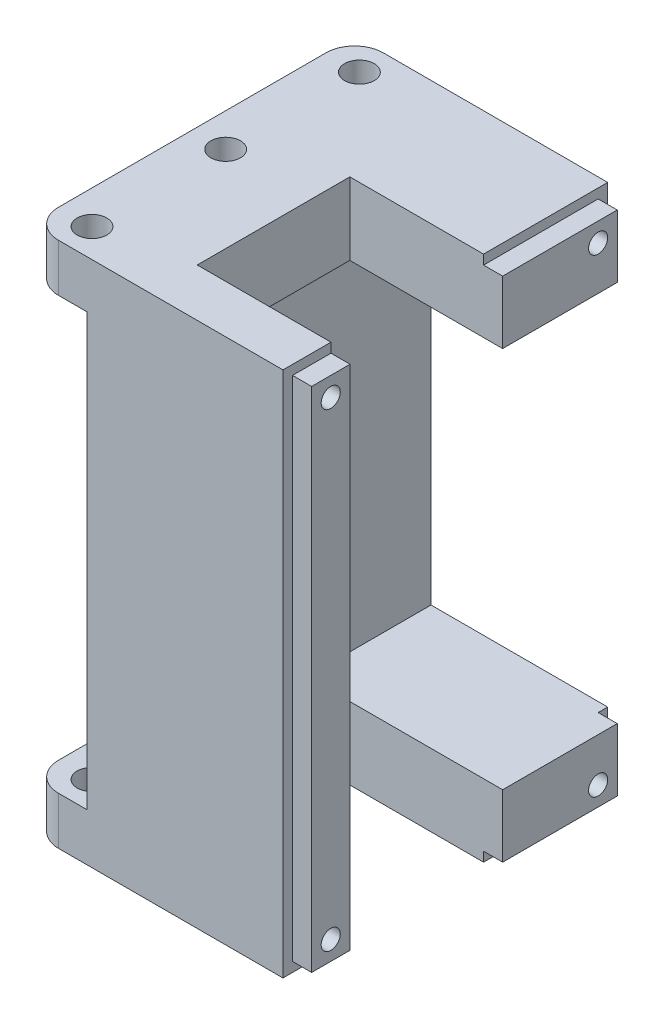
from build123d import *

# Parameters (mm, degrees)
SKETCH_1_W           = 20.5
SKETCH_1_H           = 15.141704846
SKETCH_1_R           = 2
EXTRUDE_1_DEPTH      = 29
EXTRUDE_1_2_DEPTH    = 29
SKETCH_2_W           = 20.5
SKETCH_2_H           = 70.283409692
EXTRUDE_2_DEPTH      = 3
SKETCH_3_W           = 20.5
SKETCH_3_H           = 7.570852423
CUT_EXTRUDE_1_DEPTH  = 49.621002864
EXTRUDE_3_DEPTH      = 10
CUT_EXTRUDE_2_REACH  = 75.297
SKETCH_8_R           = 1.6
SKETCH_9_W           = 20.5
SKETCH_9_H           = 32
CUT_EXTRUDE_3_DEPTH  = 65.572982844
SKETCH_12_W          = 20.5
SKETCH_12_H          = 7.570852423
SKETCH_12_R          = 2
EXTRUDE_5_DEPTH      = 30
SKETCH_13_R          = 4
SKETCH_13_R_2        = 2.5
EXTRUDE_6_DEPTH      = 10
CUT_EXTRUDE_5_DEPTH  = 48.388093988
CUT_EXTRUDE_6_DEPTH  = 51.404676959
EXTRUDE_START        = 10
EXTRUDE_7_DEPTH      = 10
CUT_EXTRUDE_7_DEPTH  = 48.388094067
CUT_EXTRUDE_8_DEPTH  = 51.404676959
SKETCH_23_W          = 20.5
SKETCH_23_H          = 55.141704846
EXTRUDE_8_DEPTH      = 2
SKETCH_24_W          = 10
SKETCH_24_H          = 55.141704846
EXTRUDE_9_DEPTH      = 2
SKETCH_25_W          = 8
SKETCH_25_H          = 7.570852423
CUT_EXTRUDE_9_DEPTH  = 16
EXTRUDE_START_2      = 20
SKETCH_26_R          = 2
EXTRUDE_10_DEPTH     = 20
SKETCH_27_W          = 16
SKETCH_27_H          = 8
CUT_EXTRUDE_10_DEPTH = 75.494994619
SKETCH_29_W          = 34
SKETCH_29_H          = 55.141704846
SKETCH_29_W_2        = 32
SKETCH_29_H_2        = 53.141704846
CUT_EXTRUDE_11_DEPTH = 2
SKETCH_32_W          = 15.976862795
SKETCH_32_H          = 55.18580585
CUT_EXTRUDE_13_DEPTH = 16
SKETCH_33_R          = 1
CUT_EXTRUDE_14_DEPTH = 16
SKETCH_35_R          = 1
CUT_EXTRUDE_15_DEPTH = 5
SKETCH_36_R          = 2.65
CUT_EXTRUDE_16_DEPTH = 10
CUT_EXTRUDE_START    = -10
SKETCH_37_R          = 2.65
CUT_EXTRUDE_17_DEPTH = 10
SKETCH_38_W          = 37
SKETCH_38_H          = 68
CUT_EXTRUDE_18_DEPTH = 10
SKETCH_39_W          = 24
SKETCH_39_H          = 55.141704846
EXTRUDE_11_DEPTH     = 2
SKETCH_40_W          = 20.5
SKETCH_40_H          = 34
CUT_EXTRUDE_19_DEPTH = 66.929281153
SKETCH_41_W          = 5
SKETCH_41_H          = 34
EXTRUDE_12_DEPTH     = 5
SKETCH_42_R          = 2
CUT_EXTRUDE_20_DEPTH = 68.038571833
SKETCH_43_W          = 1
SKETCH_43_H          = 34
EXTRUDE_13_DEPTH     = 5
SKETCH_44_W          = 34
SKETCH_44_H          = 5
EXTRUDE_14_DEPTH     = 1
EXTRUDE_START_3      = -5
SKETCH_45_R          = 2
SKETCH_45_R_2        = 1.55
EXTRUDE_15_DEPTH     = 5
SKETCH_46_R          = 2
SKETCH_46_R_2        = 1.55
EXTRUDE_16_DEPTH     = 5
FILLET_1_R           = 3
FILLET_2_R           = 3
FILLET_3_R           = 3
FILLET_4_R           = 3
SKETCH_47_R          = 2
EXTRUDE_17_DEPTH     = 10
SKETCH_48_R          = 2
CUT_EXTRUDE_21_DEPTH = 10


with BuildPart() as part:
    # 草图1 → 凸台-拉伸1 (new body)
    with BuildSketch(Plane.XY):
        with Locations((0, -27.570852423)):
            Rectangle(SKETCH_1_W, SKETCH_1_H)
        with Locations((-5, -25)):
            Circle(SKETCH_1_R, mode=Mode.SUBTRACT)
        with Locations((5, -25)):
            Circle(SKETCH_1_R, mode=Mode.SUBTRACT)
    extrude(amount=EXTRUDE_1_DEPTH)



with BuildPart() as body_2:
    # 草图1 → Extrude 1 2 (new body)
    with BuildSketch(Plane.XY):
        with Locations((0, 27.570852423)):
            Rectangle(SKETCH_1_W, SKETCH_1_H)
        with Locations((5, 25)):
            Circle(SKETCH_1_R, mode=Mode.SUBTRACT)
        with Locations((-5, 25)):
            Circle(SKETCH_1_R, mode=Mode.SUBTRACT)
    extrude(amount=EXTRUDE_1_2_DEPTH)


with BuildPart() as part_1:
    add(part.part)

    add(body_2.part)  # 凸台-拉伸2 merges body 2
    # 草图2 → 凸台-拉伸2 (add)
    with BuildSketch(Plane.XY.offset(29)):
        Rectangle(SKETCH_2_W, SKETCH_2_H)
    extrude(amount=EXTRUDE_2_DEPTH)

    # 草图3 → 切除-拉伸1 (cut, through all)
    with BuildSketch(Plane(origin=(0, 0, 0), x_dir=(-1, 0, 0), z_dir=(0, 0, -1))):
        with Locations((0, -31.356278635)):
            Rectangle(SKETCH_3_W, SKETCH_3_H)
        with Locations((0, 31.356278635)):
            Rectangle(SKETCH_3_W, SKETCH_3_H)
    extrude(amount=-CUT_EXTRUDE_1_DEPTH, mode=Mode.SUBTRACT)

    # 草图5 → 凸台-拉伸3 (add)
    with BuildSketch(Plane.XZ.offset(27.570852423)):
        with BuildLine():
            ThreePointArc((0, 0), (1.767766953, 0.732233047), (2.5, 2.5))
            ThreePointArc((2.5, 2.5), (-1.767766953, 4.267766953), (0, 0))
        make_face()
    extrude(amount=EXTRUDE_3_DEPTH)

    # 草图8 → 切除-拉伸2 (cut, up to next)
    with BuildSketch(Plane(origin=(0, 27.570852423, 0), x_dir=(1, 0, 0), z_dir=(0, 1, 0)), mode=Mode.PRIVATE) as cut_extrude_2_sk1:
        with Locations((0, -16.5)):
            Circle(SKETCH_8_R)
    cut_extrude_2_tool1 = extrude(cut_extrude_2_sk1.sketch, amount=-CUT_EXTRUDE_2_REACH, mode=Mode.PRIVATE) & part_1.part
    # 草图8 → 切除-拉伸2 (cut, up to next)
    with BuildSketch(Plane(origin=(0, 27.570852423, 0), x_dir=(1, 0, 0), z_dir=(0, 1, 0)), mode=Mode.PRIVATE) as cut_extrude_2_sk2:
        with Locations((0, -26.5)):
            Circle(SKETCH_8_R)
    cut_extrude_2_tool2 = extrude(cut_extrude_2_sk2.sketch, amount=-CUT_EXTRUDE_2_REACH, mode=Mode.PRIVATE) & part_1.part
    add(cut_extrude_2_tool1.solids().sort_by_distance((0, 27.570852, 16.5))[0], mode=Mode.SUBTRACT)
    add(cut_extrude_2_tool2.solids().sort_by_distance((0, 27.570852, 26.5))[0], mode=Mode.SUBTRACT)

    # 草图9 → 切除-拉伸3 (cut, through all)
    with BuildSketch(Plane.XZ.offset(27.570852423)):
        with Locations((0, 16)):
            Rectangle(SKETCH_9_W, SKETCH_9_H)
    extrude(amount=CUT_EXTRUDE_3_DEPTH, mode=Mode.SUBTRACT)

    # 草图12 → 凸台-拉伸5 (add)
    with BuildSketch(Plane(origin=(0, 0, 0), x_dir=(-1, 0, 0), z_dir=(0, 0, -1))):
        with Locations((0, 23.785426212)):
            Rectangle(SKETCH_12_W, SKETCH_12_H)
        with Locations((-5, 25)):
            Circle(SKETCH_12_R, mode=Mode.SUBTRACT)
        with Locations((5, 25)):
            Circle(SKETCH_12_R, mode=Mode.SUBTRACT)
    extrude(amount=-EXTRUDE_5_DEPTH)

    # 草图13 → 凸台-拉伸6 (add)
    with BuildSketch(Plane(origin=(0, 27.570852423, 0), x_dir=(1, 0, 0), z_dir=(0, 1, 0))):
        with Locations((0, -5)):
            Circle(SKETCH_13_R)
        with Locations((0, -5)):
            Circle(SKETCH_13_R_2, mode=Mode.SUBTRACT)
    extrude(amount=EXTRUDE_6_DEPTH)

    # 草图15 → 旋转1 (revolve)
    with BuildSketch(Plane(origin=(0, 0, 0), x_dir=(0, 0, -1), z_dir=(1, 0, 0))):
        with BuildLine():
            Line((-1, 27.570852423), (0, 27.570852423))
            ThreePointArc((0, 27.570852423), (-0.712891912, 27.930797461), (-1, 28.676011695))
            Line((-1, 28.676011695), (-1, 27.570852423))
        make_face()
    revolve(axis=Axis((0, -962.429147577, 5), (0, 1, 0)))

    # 草图16 → 切除-拉伸5 (cut, through all)
    with BuildSketch(Plane.XY.offset(5)):
        with BuildLine():
            ThreePointArc((0, 35.070852423), (-1.060660172, 32.510192251), (1.5, 33.570852423))
            ThreePointArc((1.5, 33.570852423), (1.060660172, 34.631512595), (0, 35.070852423))
        make_face()
    extrude(amount=-CUT_EXTRUDE_5_DEPTH, mode=Mode.SUBTRACT)

    # 草图17 → 切除-拉伸6 (cut, through all)
    with BuildSketch(Plane(origin=(0, 0, 0), x_dir=(0, 0, -1), z_dir=(1, 0, 0))):
        with BuildLine():
            ThreePointArc((-5, 35.070852423), (-6.060660172, 32.510192251), (-3.5, 33.570852423))
            ThreePointArc((-3.5, 33.570852423), (-3.939339828, 34.631512595), (-5, 35.070852423))
        make_face()
    extrude(amount=-CUT_EXTRUDE_6_DEPTH, mode=Mode.SUBTRACT)

    # 草图19 → 凸台-拉伸7 (add)
    with BuildSketch(Plane.XZ.offset(27.570852423).offset(EXTRUDE_START)):
        with BuildLine():
            ThreePointArc((4, 5), (-2.828427125, 7.828427125), (0, 1))
            ThreePointArc((0, 1), (2.828427125, 2.171572875), (4, 5))
        make_face()
        with BuildLine():
            ThreePointArc((2.5, 5), (1.767766953, 3.232233047), (0, 2.5))
            ThreePointArc((0, 2.5), (-1.767766953, 6.767766953), (2.5, 5))
        make_face(mode=Mode.SUBTRACT)
    extrude(amount=-EXTRUDE_7_DEPTH)

    # 草图20 → 旋转2 (revolve)
    with BuildSketch(Plane(origin=(0, 0, 0), x_dir=(0, 0, -1), z_dir=(1, 0, 0))):
        with BuildLine():
            Line((-1, -27.570852423), (0, -27.570852423))
            ThreePointArc((0, -27.570852423), (-0.707106781, -27.863745642), (-1, -28.570852423))
            Line((-1, -28.570852423), (-1, -27.570852423))
        make_face()
    revolve(axis=Axis((0, -1027.570852423, 5), (0, 1, 0)))

    # 草图21 → 切除-拉伸7 (cut, through all)
    with BuildSketch(Plane.XY.offset(5)):
        with BuildLine():
            ThreePointArc((0, -35.070852423), (1.060660172, -34.631512595), (1.5, -33.570852423))
            ThreePointArc((1.5, -33.570852423), (-1.060660172, -32.510192251), (0, -35.070852423))
        make_face()
    extrude(amount=-CUT_EXTRUDE_7_DEPTH, mode=Mode.SUBTRACT)

    # 草图22 → 切除-拉伸8 (cut, through all)
    with BuildSketch(Plane(origin=(0, 0, 0), x_dir=(0, 0, -1), z_dir=(1, 0, 0))):
        with BuildLine():
            ThreePointArc((-5, -35.070852423), (-3.939339828, -34.631512595), (-3.5, -33.570852423))
            ThreePointArc((-3.5, -33.570852423), (-6.060660172, -32.510192251), (-5, -35.070852423))
        make_face()
    extrude(amount=-CUT_EXTRUDE_8_DEPTH, mode=Mode.SUBTRACT)

    # 草图23 → 凸台-拉伸8 (add)
    with BuildSketch(Plane.XY.offset(32)):
        Rectangle(SKETCH_23_W, SKETCH_23_H)
    extrude(amount=EXTRUDE_8_DEPTH)

    # 草图24 → 凸台-拉伸9 (add)
    with BuildSketch(Plane.ZY.offset(10.25)):
        with Locations((29, 0)):
            Rectangle(SKETCH_24_W, SKETCH_24_H)
    extrude(amount=EXTRUDE_9_DEPTH)

    # 草图25 → 切除-拉伸9 (cut)
    with BuildSketch(Plane(origin=(10.25, 0, 0), x_dir=(0, 0, -1), z_dir=(1, 0, 0))):
        with Locations((-21, 23.785426212)):
            Rectangle(SKETCH_25_W, SKETCH_25_H)
        with Locations((-21, -23.785426212)):
            Rectangle(SKETCH_25_W, SKETCH_25_H)
    extrude(amount=-CUT_EXTRUDE_9_DEPTH, mode=Mode.SUBTRACT)

    # 草图26 → 凸台-拉伸10 (add)
    with BuildSketch(Plane(origin=(0, 0, 29), x_dir=(-1, 0, 0), z_dir=(0, 0, -1)).offset(EXTRUDE_START_2)):
        with Locations((-5, 25)):
            Circle(SKETCH_26_R)
        with Locations((5, 25)):
            Circle(SKETCH_26_R)
        with Locations((-5, -25)):
            Circle(SKETCH_26_R)
        with Locations((5, -25)):
            Circle(SKETCH_26_R)
    extrude(amount=-EXTRUDE_10_DEPTH)

    # 草图27 → 切除-拉伸10 (cut, through all)
    with BuildSketch(Plane.XZ.offset(27.570852423)):
        with Locations((2.25, 21)):
            Rectangle(SKETCH_27_W, SKETCH_27_H)
    extrude(amount=-CUT_EXTRUDE_10_DEPTH, mode=Mode.SUBTRACT)

    # 草图29 → 切除-拉伸11 (cut)
    with BuildSketch(Plane(origin=(10.25, 0, 0), x_dir=(0, 0, -1), z_dir=(1, 0, 0))):
        with Locations((-17, 0)):
            Rectangle(SKETCH_29_W, SKETCH_29_H)
        with Locations((-17, 0)):
            Rectangle(SKETCH_29_W_2, SKETCH_29_H_2, mode=Mode.SUBTRACT)
    extrude(amount=-CUT_EXTRUDE_11_DEPTH, mode=Mode.SUBTRACT)

    # 草图32 → 切除-拉伸13 (cut)
    with BuildSketch(Plane(origin=(10.25, 0, 0), x_dir=(0, 0, -1), z_dir=(1, 0, 0))):
        with Locations((-20.988431398, 0.000987062)):
            Rectangle(SKETCH_32_W, SKETCH_32_H)
    extrude(amount=-CUT_EXTRUDE_13_DEPTH, mode=Mode.SUBTRACT)

    # 草图33 → 切除-拉伸14 (cut)
    with BuildSketch(Plane(origin=(10.25, 0, 0), x_dir=(0, 0, -1), z_dir=(1, 0, 0))):
        with Locations((-31, 24.570852423)):
            Circle(SKETCH_33_R)
        with Locations((-31, -24.570852423)):
            Circle(SKETCH_33_R)
    extrude(amount=-CUT_EXTRUDE_14_DEPTH, mode=Mode.SUBTRACT)

    # 草图35 → 切除-拉伸15 (cut)
    with BuildSketch(Plane(origin=(10.25, 0, 0), x_dir=(0, 0, -1), z_dir=(1, 0, 0))):
        with Locations((-3, 24.570852423)):
            Circle(SKETCH_35_R)
        with Locations((-3, -24.570852423)):
            Circle(SKETCH_35_R)
    extrude(amount=-CUT_EXTRUDE_15_DEPTH, mode=Mode.SUBTRACT)

    # 草图36 → 切除-拉伸16 (cut)
    with BuildSketch(Plane.XZ.offset(37.570852423)):
        with Locations((0, 5)):
            Circle(SKETCH_36_R)
    extrude(amount=-CUT_EXTRUDE_16_DEPTH, mode=Mode.SUBTRACT)

    # 草图37 → 切除-拉伸17 (cut)
    with BuildSketch(Plane(origin=(0, 37.570852423, 0), x_dir=(1, 0, 0), z_dir=(0, 1, 0)).offset(CUT_EXTRUDE_START)):
        with Locations((0, -5)):
            Circle(SKETCH_37_R)
    extrude(amount=CUT_EXTRUDE_17_DEPTH, mode=Mode.SUBTRACT)

    # 草图38 → 切除-拉伸18 (cut)
    with BuildSketch(Plane.XZ.offset(27.570852423)):
        with Locations((-10.25, 0)):
            Rectangle(SKETCH_38_W, SKETCH_38_H)
    extrude(amount=CUT_EXTRUDE_18_DEPTH, mode=Mode.SUBTRACT)

    # 草图39 → 凸台-拉伸11 (add)
    with BuildSketch(Plane.ZY.offset(10.25)):
        with Locations((12, 0)):
            Rectangle(SKETCH_39_W, SKETCH_39_H)
    extrude(amount=EXTRUDE_11_DEPTH)

    # 草图40 → 切除-拉伸19 (cut, through all)
    with BuildSketch(Plane(origin=(0, 27.570852423, 0), x_dir=(1, 0, 0), z_dir=(0, 1, 0))):
        with Locations((-2, -17)):
            Rectangle(SKETCH_40_W, SKETCH_40_H)
    extrude(amount=CUT_EXTRUDE_19_DEPTH, mode=Mode.SUBTRACT)

    # 草图41 → 凸台-拉伸12 (add)
    with BuildSketch(Plane(origin=(0, 27.570852423, 0), x_dir=(1, 0, 0), z_dir=(0, 1, 0))):
        with Locations((-14.75, -17)):
            Rectangle(SKETCH_41_W, SKETCH_41_H)
    extrude_12 = extrude(amount=-EXTRUDE_12_DEPTH)

    # 镜向1: 凸台-拉伸12 across plane
    add(extrude_12.mirror(Plane.ZX))

    # 草图42 → 切除-拉伸20 (cut, through all)
    with BuildSketch(Plane.XZ.offset(27.570852423)):
        with Locations((-14.75, 3)):
            Circle(SKETCH_42_R)
        with Locations((-14.75, 31)):
            Circle(SKETCH_42_R)
        with Locations((-14.75, 17)):
            Circle(SKETCH_42_R)
    extrude(amount=-CUT_EXTRUDE_20_DEPTH, mode=Mode.SUBTRACT)

    # 草图43 → 凸台-拉伸13 (add)
    with BuildSketch(Plane.XZ.offset(27.570852423)):
        with Locations((-17.75, 17)):
            Rectangle(SKETCH_43_W, SKETCH_43_H)
    extrude(amount=-EXTRUDE_13_DEPTH)

    # 草图44 → 凸台-拉伸14 (add)
    with BuildSketch(Plane.ZY.offset(17.25)):
        with Locations((17, 25.070852423)):
            Rectangle(SKETCH_44_W, SKETCH_44_H)
    extrude(amount=EXTRUDE_14_DEPTH)

    # 草图45 → 凸台-拉伸15 (add)
    # profile 1 of 3: a face of its own
    with BuildSketch(Plane(origin=(0, 27.570852423, 0), x_dir=(1, 0, 0), z_dir=(0, 1, 0)).offset(EXTRUDE_START_3)):
        with Locations((-14.75, -3)):
            Circle(SKETCH_45_R)
        with Locations((-14.75, -3)):
            Circle(SKETCH_45_R_2, mode=Mode.SUBTRACT)
    # profile 2 of 3: a face of its own
    with BuildSketch(Plane(origin=(0, 27.570852423, 0), x_dir=(1, 0, 0), z_dir=(0, 1, 0)).offset(EXTRUDE_START_3)):
        with Locations((-14.75, -17)):
            Circle(SKETCH_45_R)
        with Locations((-14.75, -17)):
            Circle(SKETCH_45_R_2, mode=Mode.SUBTRACT)
    # profile 3 of 3: a face of its own
    with BuildSketch(Plane(origin=(0, 27.570852423, 0), x_dir=(1, 0, 0), z_dir=(0, 1, 0)).offset(EXTRUDE_START_3)):
        with Locations((-14.75, -31)):
            Circle(SKETCH_45_R)
        with Locations((-14.75, -31)):
            Circle(SKETCH_45_R_2, mode=Mode.SUBTRACT)
    extrude(amount=EXTRUDE_15_DEPTH)

    # 草图46 → 凸台-拉伸16 (add)
    # profile 1 of 3: a face of its own
    with BuildSketch(Plane.XZ.offset(27.570852423)):
        with Locations((-14.75, 31)):
            Circle(SKETCH_46_R)
        with Locations((-14.75, 31)):
            Circle(SKETCH_46_R_2, mode=Mode.SUBTRACT)
    # profile 2 of 3: a face of its own
    with BuildSketch(Plane.XZ.offset(27.570852423)):
        with Locations((-14.75, 17)):
            Circle(SKETCH_46_R)
        with Locations((-14.75, 17)):
            Circle(SKETCH_46_R_2, mode=Mode.SUBTRACT)
    # profile 3 of 3: a face of its own
    with BuildSketch(Plane.XZ.offset(27.570852423)):
        with Locations((-14.75, 3)):
            Circle(SKETCH_46_R)
        with Locations((-14.75, 3)):
            Circle(SKETCH_46_R_2, mode=Mode.SUBTRACT)
    extrude(amount=-EXTRUDE_16_DEPTH)

    # 圆角1
    fillet_1_edges = [part_1.edges().sort_by_distance(p)[0] for p in [
        (-18.25, -25.070852423, 0),
    ]]
    fillet(fillet_1_edges, radius=FILLET_1_R)

    # 圆角2
    fillet_2_edges = [part_1.edges().sort_by_distance(p)[0] for p in [
        (-18.25, -25.070852423, 34),
    ]]
    fillet(fillet_2_edges, radius=FILLET_2_R)

    # 圆角3
    fillet_3_edges = [part_1.edges().sort_by_distance(p)[0] for p in [
        (-18.25, 25.070852423, 0),
    ]]
    fillet(fillet_3_edges, radius=FILLET_3_R)

    # 圆角4
    fillet_4_edges = [part_1.edges().sort_by_distance(p)[0] for p in [
        (-18.25, 25.070852423, 34),
    ]]
    fillet(fillet_4_edges, radius=FILLET_4_R)

    # 草图47 → 凸台-拉伸17 (add)
    with BuildSketch(Plane(origin=(0, 0, 0), x_dir=(-1, 0, 0), z_dir=(0, 0, -1))):
        with Locations((-5, 25)):
            Circle(SKETCH_47_R)
        with Locations((5, 25)):
            Circle(SKETCH_47_R)
        with Locations((-5, -25)):
            Circle(SKETCH_47_R)
        with Locations((5, -25)):
            Circle(SKETCH_47_R)
    extrude(amount=-EXTRUDE_17_DEPTH)

    # 草图48 → 切除-拉伸21 (cut)
    with BuildSketch(Plane(origin=(0, 0, 0), x_dir=(-1, 0, 0), z_dir=(0, 0, -1))):
        with Locations((-5, 24.5)):
            Circle(SKETCH_48_R)
        with Locations((5, 24.5)):
            Circle(SKETCH_48_R)
        with Locations((5, -24.5)):
            Circle(SKETCH_48_R)
        with Locations((-5, -24.5)):
            Circle(SKETCH_48_R)
    extrude(amount=-CUT_EXTRUDE_21_DEPTH, mode=Mode.SUBTRACT)


solid = part_1.part
